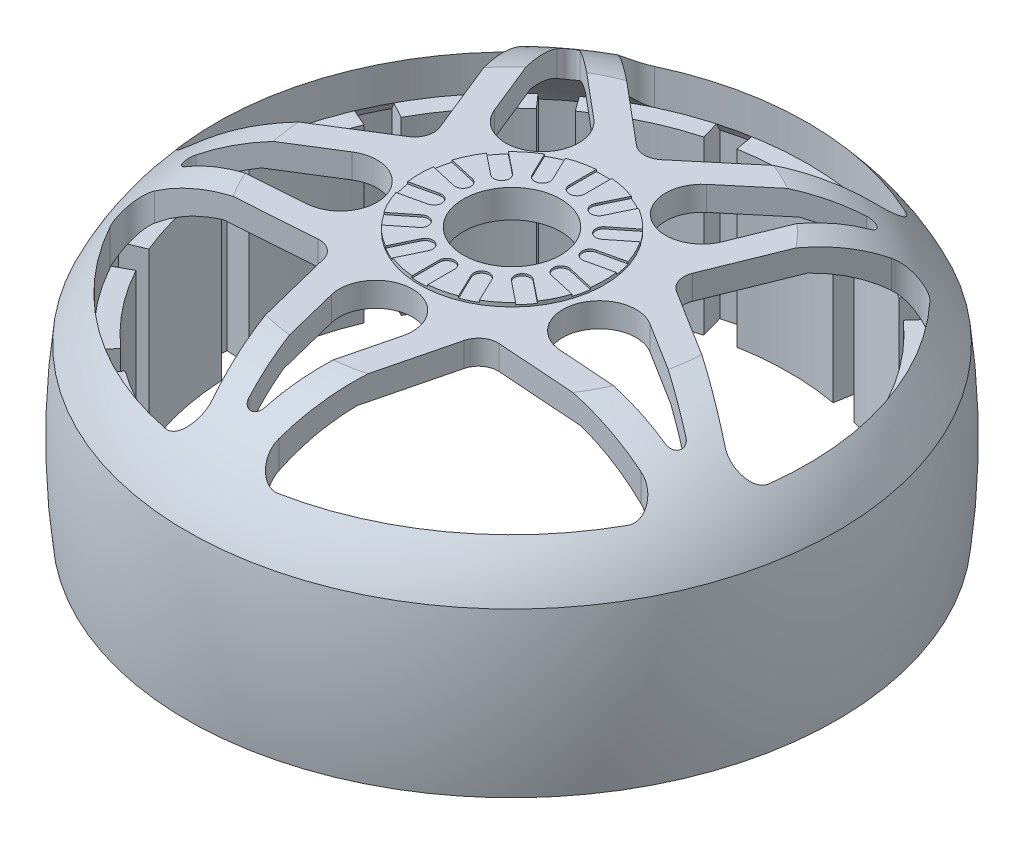
from build123d import *

# Parameters (mm, degrees)
SKETCH_3_R               = 2.5
CUT_EXTRUDE_1_DEPTH      = 28.462064916
CUT_EXTRUDE_2_DEPTH      = 28.462064916
PATTERN_CIRCULAR_1_COUNT = 5
CUT_EXTRUDE_3_DEPTH      = 28.462064916
PATTERN_CIRCULAR_2_COUNT = 5
EXTRUDE_START            = -8.821171
EXTRUDE_1_DEPTH          = 8.821171
PATTERN_CIRCULAR_5_COUNT = 14
FILLET_1_R               = 1
SKETCH_7_R               = 4.75
SKETCH_7_R_2             = 2.5
EXTRUDE_2_DEPTH          = 0.2
CUT_EXTRUDE_4_DEPTH      = 0.1
PATTERN_CIRCULAR_6_COUNT = 14


with BuildPart() as part:
    # Эскиз1 → Повернуть1 (revolve)
    with BuildSketch(Plane.XY, mode=Mode.PRIVATE) as revolve_1_sk:
        with BuildLine():
            Line((-16.7, 0), (-15.45, 0))
            Line((-15.45, 0), (-15.45, 8.4))
            Line((-15.45, 8.4), (-16.7, 8.4))
            ThreePointArc((-16.7, 8.4), (-16.95, 4.2), (-16.7, 0))
        make_face()
    revolve(revolve_1_sk.sketch.rotate(Axis((0, 0, 0), (0, 1, 0)), 270), axis=Axis((0, 0, 0), (0, 1, 0)))


with BuildPart() as body_2:
    # Эскиз2 → Повернуть2 (revolve)
    with BuildSketch(Plane.XY, mode=Mode.PRIVATE) as revolve_2_sk:
        with BuildLine():
            Line((-10.375, 13.4), (0, 13.4))
            Line((0, 13.4), (0, 12.15))
            Line((0, 12.15), (-10.78118876, 12.15))
            ThreePointArc((-10.78118876, 12.15), (-13.485417923, 10.735436351), (-15.45, 8.4))
            Line((-15.45, 8.4), (-16.7, 8.4))
            ThreePointArc((-16.7, 8.4), (-14.128716315, 11.647888638), (-10.375, 13.4))
        make_face()
    revolve(revolve_2_sk.sketch.rotate(Axis((0, 0, 0), (0, 1, 0)), 270), axis=Axis((0, 0, 0), (0, 1, 0)))

    # Эскиз3 → Вырез-Вытянуть1 (cut, through all)
    with BuildSketch(Plane(origin=(0, 0, 0), x_dir=(1, 0, 0), z_dir=(0, 1, 0))):
        with Locations(Location((0, 0, 0), (0, 0, 270))):
            Circle(SKETCH_3_R)
    extrude(amount=CUT_EXTRUDE_1_DEPTH, mode=Mode.SUBTRACT)

    # Эскиз4 → Вырез-Вытянуть2 (cut, through all)
    with BuildSketch(Plane(origin=(0, 0, 0), x_dir=(1, 0, 0), z_dir=(0, 1, 0))):
        with BuildLine():
            Line((-7.800762051, 13.04561656), (0, 6.5))
            Line((0, 6.5), (7.800762051, 13.04561656))
            ThreePointArc((7.800762051, 13.04561656), (0, 15.2), (-7.800762051, 13.04561656))
        make_face()
    cut_extrude_2 = extrude(amount=CUT_EXTRUDE_2_DEPTH, mode=Mode.SUBTRACT)

    # Круговой массив1: Вырез-Вытянуть2 ×5 about axis
    pattern_circular_1_axis = Axis((0, 0, 0), (0, 1, 0))
    for i in range(1, PATTERN_CIRCULAR_1_COUNT):
        add(cut_extrude_2.rotate(pattern_circular_1_axis, i * 360 / PATTERN_CIRCULAR_1_COUNT), mode=Mode.SUBTRACT)

    # Эскиз5 → Вырез-Вытянуть3 (cut, through all)
    with BuildSketch(Plane(origin=(0, 0, 0), x_dir=(1, 0, 0), z_dir=(0, 1, 0))):
        with BuildLine():
            Line((7.362042897, 10.849917275), (2.902305001, 7.107752851))
            ThreePointArc((2.902305001, 7.107752851), (3.006030406, 4.137445903), (5.863013097, 4.956672507))
            Line((5.863013097, 4.956672507), (8.043888157, 10.354527696))
            ThreePointArc((8.043888157, 10.354527696), (7.896485906, 10.868580436), (7.362042897, 10.849917275))
        make_face()
    cut_extrude_3 = extrude(amount=CUT_EXTRUDE_3_DEPTH, mode=Mode.SUBTRACT)

    # Круговой массив2: Вырез-Вытянуть3 ×5 about axis
    pattern_circular_2_axis = Axis((0, 0, 0), (0, 1, 0))
    for i in range(1, PATTERN_CIRCULAR_2_COUNT):
        add(cut_extrude_3.rotate(pattern_circular_2_axis, i * 360 / PATTERN_CIRCULAR_2_COUNT), mode=Mode.SUBTRACT)

    # Скругление1
    fillet_1_edges = [body_2.edges().sort_by_distance(p)[0] for p in [
        (13.978970089, 9.735137871, 5.968952609),
        (1.357071953, 9.735137871, 15.139298389),
        (3.82060414, 12.775, 5.258610463),
        (9.996550595, 9.735137871, -11.4502828),
        (14.817686681, 9.735137871, 3.387648361),
        (6.181867356, 12.775, -2.008610463),
        (-7.800762051, 9.735137871, -13.04561656),
        (7.800762051, 9.735137871, -13.04561656),
        (0, 12.775, -6.5),
        (-9.996550595, 9.735137871, -11.4502828),
        (-14.817686681, 9.735137871, 3.387648361),
        (-6.181867356, 12.775, -2.008610463),
        (-13.978970089, 9.735137871, 5.968952609),
        (-1.357071953, 9.735137871, 15.139298389),
        (-3.82060414, 12.775, 5.258610463),
    ]]
    fillet(fillet_1_edges, radius=FILLET_1_R)

    # Эскиз7 → Бобышка-Вытянуть2 (add)
    with BuildSketch(Plane(origin=(0, 13.4, 0), x_dir=(1, 0, 0), z_dir=(0, 1, 0))):
        with Locations(Location((0, 0, 0), (0, 0, 90))):
            Circle(SKETCH_7_R)
        with Locations(Location((0, 0, 0), (0, 0, 270))):
            Circle(SKETCH_7_R_2, mode=Mode.SUBTRACT)
    extrude(amount=EXTRUDE_2_DEPTH)

    # Эскиз8 → Вырез-Вытянуть4 (cut)
    with BuildSketch(Plane(origin=(0, 13.6, 0), x_dir=(1, 0, 0), z_dir=(0, 1, 0))):
        with BuildLine():
            Line((0.4, 3.35), (0.4, 4.73312793))
            ThreePointArc((0.4, 4.73312793), (0, 4.75), (-0.4, 4.73312793))
            Line((-0.4, 4.73312793), (-0.4, 3.35))
            ThreePointArc((-0.4, 3.35), (0, 2.95), (0.4, 3.35))
        make_face()
    cut_extrude_4 = extrude(amount=-CUT_EXTRUDE_4_DEPTH, mode=Mode.SUBTRACT)

    # Круговой массив6: Вырез-Вытянуть4 ×14 about axis
    pattern_circular_6_axis = Axis((0, 0, 0), (0, 1, 0))
    for i in range(1, PATTERN_CIRCULAR_6_COUNT):
        add(cut_extrude_4.rotate(pattern_circular_6_axis, i * 360 / PATTERN_CIRCULAR_6_COUNT), mode=Mode.SUBTRACT)


with BuildPart() as body_3:
    # Эскиз6 → Бобышка-Вытянуть1 (new body)
    with BuildSketch(Plane.XZ.offset(EXTRUDE_START)):
        with BuildLine():
            Line((-2.682864345, 15.215279784), (-2.474486532, 14.03351048))
            ThreePointArc((-2.474486532, 14.03351048), (0, 14.25), (2.474486532, 14.03351048))
            Line((2.474486532, 14.03351048), (2.682864345, 15.215279784))
            ThreePointArc((2.682864345, 15.215279784), (0, 15.45), (-2.682864345, 15.215279784))
        make_face()
    extrude(amount=EXTRUDE_1_DEPTH)


with BuildPart() as pattern_circular_5_1:
    # Круговой массив5: pattern copy
    add(body_3.part.rotate(Axis((0, 0, 0), (0, 1, 0)), 1 * 360 / PATTERN_CIRCULAR_5_COUNT))


with BuildPart() as pattern_circular_5_2:
    # Круговой массив5: pattern copy
    add(body_3.part.rotate(Axis((0, 0, 0), (0, 1, 0)), 2 * 360 / PATTERN_CIRCULAR_5_COUNT))


with BuildPart() as pattern_circular_5_3:
    # Круговой массив5: pattern copy
    add(body_3.part.rotate(Axis((0, 0, 0), (0, 1, 0)), 3 * 360 / PATTERN_CIRCULAR_5_COUNT))


with BuildPart() as pattern_circular_5_4:
    # Круговой массив5: pattern copy
    add(body_3.part.rotate(Axis((0, 0, 0), (0, 1, 0)), 4 * 360 / PATTERN_CIRCULAR_5_COUNT))


with BuildPart() as pattern_circular_5_5:
    # Круговой массив5: pattern copy
    add(body_3.part.rotate(Axis((0, 0, 0), (0, 1, 0)), 5 * 360 / PATTERN_CIRCULAR_5_COUNT))


with BuildPart() as pattern_circular_5_6:
    # Круговой массив5: pattern copy
    add(body_3.part.rotate(Axis((0, 0, 0), (0, 1, 0)), 6 * 360 / PATTERN_CIRCULAR_5_COUNT))


with BuildPart() as pattern_circular_5_7:
    # Круговой массив5: pattern copy
    add(body_3.part.rotate(Axis((0, 0, 0), (0, 1, 0)), 7 * 360 / PATTERN_CIRCULAR_5_COUNT))


with BuildPart() as pattern_circular_5_8:
    # Круговой массив5: pattern copy
    add(body_3.part.rotate(Axis((0, 0, 0), (0, 1, 0)), 8 * 360 / PATTERN_CIRCULAR_5_COUNT))


with BuildPart() as pattern_circular_5_9:
    # Круговой массив5: pattern copy
    add(body_3.part.rotate(Axis((0, 0, 0), (0, 1, 0)), 9 * 360 / PATTERN_CIRCULAR_5_COUNT))


with BuildPart() as pattern_circular_5_10:
    # Круговой массив5: pattern copy
    add(body_3.part.rotate(Axis((0, 0, 0), (0, 1, 0)), 10 * 360 / PATTERN_CIRCULAR_5_COUNT))


with BuildPart() as pattern_circular_5_11:
    # Круговой массив5: pattern copy
    add(body_3.part.rotate(Axis((0, 0, 0), (0, 1, 0)), 11 * 360 / PATTERN_CIRCULAR_5_COUNT))


with BuildPart() as pattern_circular_5_12:
    # Круговой массив5: pattern copy
    add(body_3.part.rotate(Axis((0, 0, 0), (0, 1, 0)), 12 * 360 / PATTERN_CIRCULAR_5_COUNT))


with BuildPart() as pattern_circular_5_13:
    # Круговой массив5: pattern copy
    add(body_3.part.rotate(Axis((0, 0, 0), (0, 1, 0)), 13 * 360 / PATTERN_CIRCULAR_5_COUNT))


solid = Compound([part.part, body_2.part, body_3.part, pattern_circular_5_1.part, pattern_circular_5_2.part, pattern_circular_5_3.part, pattern_circular_5_4.part, pattern_circular_5_5.part, pattern_circular_5_6.part, pattern_circular_5_7.part, pattern_circular_5_8.part, pattern_circular_5_9.part, pattern_circular_5_10.part, pattern_circular_5_11.part, pattern_circular_5_12.part, pattern_circular_5_13.part])
